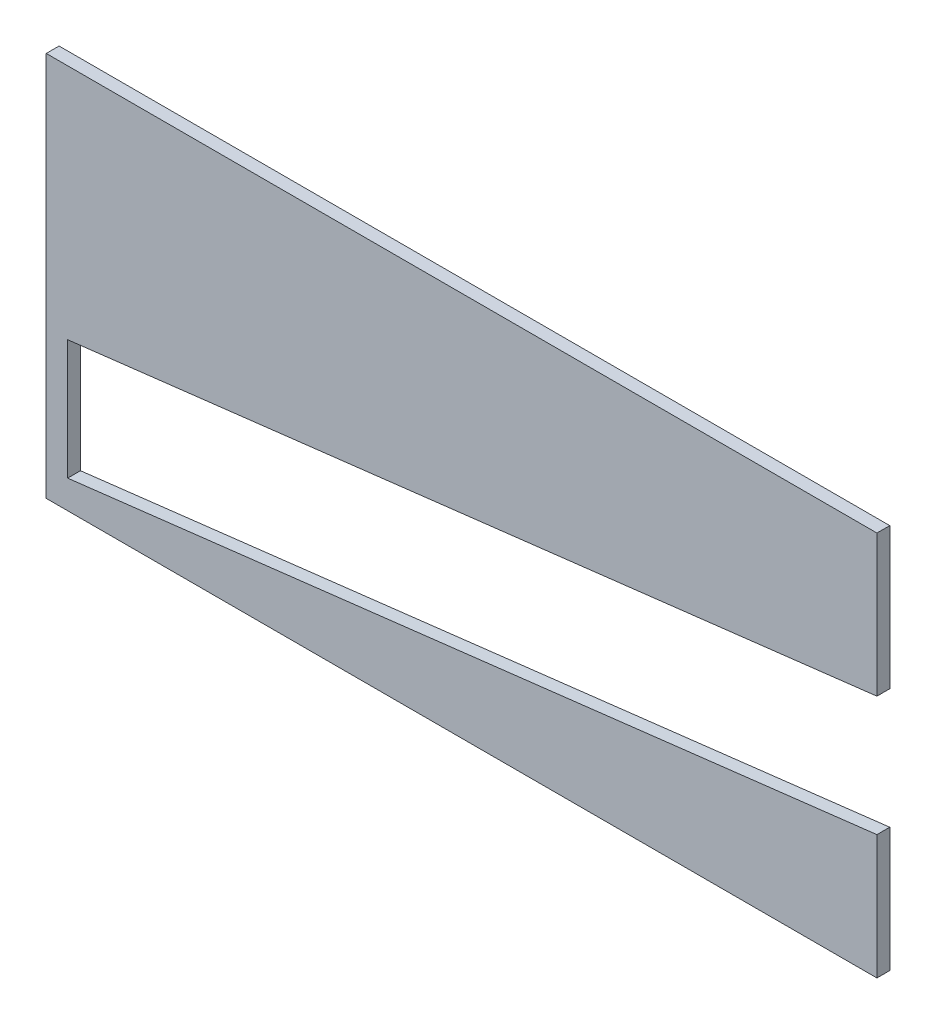
from build123d import *

# Parameters (mm, degrees)
EXTRUDE_1_DEPTH = 3


with BuildPart() as part:
    # 草圖1 → 填料-伸長1 (new body)
    with BuildSketch(Plane.XY):
        Polygon((-90.682204677, -39.441198502), (-90.682204677, -11.441198502), (98.317795323, 10.958801498), (98.317795323, 43.958801498), (-95.682204677, 43.958801498), (-95.682204677, -46.041198502), (98.317795323, -46.041198502), (98.317795323, -17.041198502), align=None)
    extrude(amount=EXTRUDE_1_DEPTH)


solid = part.part
